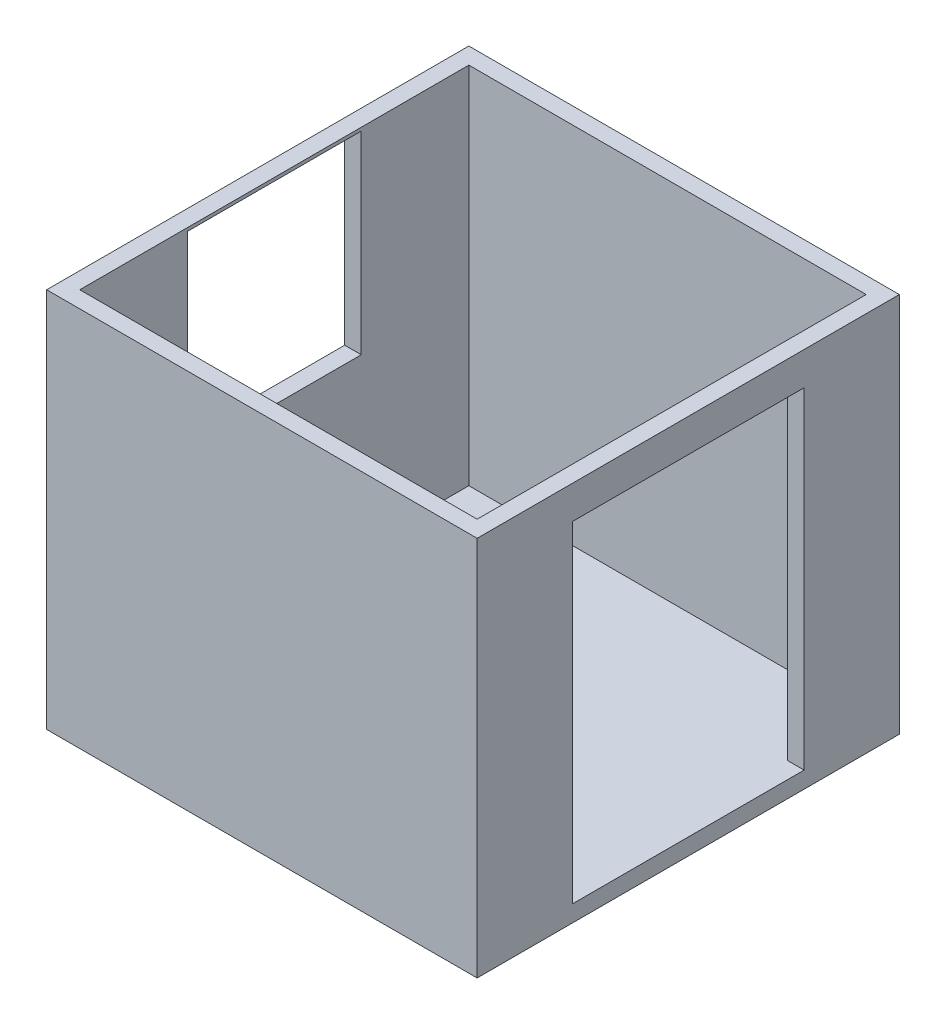
from build123d import *

# Parameters (mm, degrees)
SKETCH_1_W             = 2600
SKETCH_1_H             = 2550
SKETCH_1_W_2           = 2400
SKETCH_1_H_2           = 2350
EXTRUDE_327_DEPTH      = 2200
SKETCH_2_W             = 2600
SKETCH_2_H             = 2550
EXTRUDE_523_DEPTH      = 100
CUT_EXTRUDE_725_REACH  = 3638.705
SKETCH_5_W             = 1400
SKETCH_5_H             = 2000
CUT_EXTRUDE_1054_REACH = 3638.705
SKETCH_6_W             = 1050
SKETCH_6_H             = 1170


with BuildPart() as part:
    # 스케치1 → Extrude 327 (new body)
    with BuildSketch(Plane(origin=(0, 0, 0), x_dir=(1, 0, 0), z_dir=(0, 1, 0))):
        Rectangle(SKETCH_1_W, SKETCH_1_H)
        Rectangle(SKETCH_1_W_2, SKETCH_1_H_2, mode=Mode.SUBTRACT)
    extrude(amount=EXTRUDE_327_DEPTH)

    # 스케치2 → Extrude 523 (add)
    with BuildSketch(Plane.XZ):
        Rectangle(SKETCH_2_W, SKETCH_2_H)
    extrude(amount=EXTRUDE_523_DEPTH)

    # 스케치5 → Cut-Extrude 725 (cut, up to next)
    with BuildSketch(Plane(origin=(1300, 0, 0), x_dir=(0, 0, -1), z_dir=(1, 0, 0)), mode=Mode.PRIVATE) as cut_extrude_725_sk1:
        with Locations((0, 1000)):
            Rectangle(SKETCH_5_W, SKETCH_5_H)
    cut_extrude_725_tool1 = extrude(cut_extrude_725_sk1.sketch, amount=-CUT_EXTRUDE_725_REACH, mode=Mode.PRIVATE) & part.part
    add(cut_extrude_725_tool1.solids().sort_by_distance((1300, 1000, 0))[0], mode=Mode.SUBTRACT)

    # 스케치6 → Cut-Extrude 1054 (cut, up to next)
    with BuildSketch(Plane.ZY.offset(1300), mode=Mode.PRIVATE) as cut_extrude_1054_sk1:
        with Locations((0, 1595)):
            Rectangle(SKETCH_6_W, SKETCH_6_H)
    cut_extrude_1054_tool1 = extrude(cut_extrude_1054_sk1.sketch, amount=-CUT_EXTRUDE_1054_REACH, mode=Mode.PRIVATE) & part.part
    add(cut_extrude_1054_tool1.solids().sort_by_distance((-1300, 1595, 0))[0], mode=Mode.SUBTRACT)


solid = part.part
